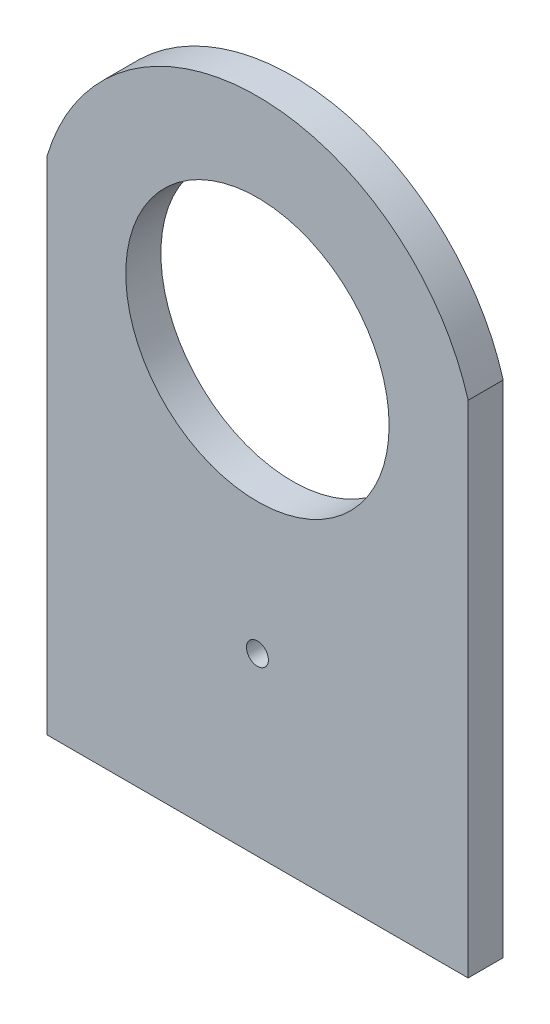
from build123d import *

# Parameters (mm, degrees)
SKETCH_1_R          = 30
EXTRUDE_1_DEPTH     = 8
SKETCH_2_R          = 2.5
CUT_EXTRUDE_1_DEPTH = 50
SKETCH_3_R          = 2.5
CUT_EXTRUDE_2_DEPTH = 20


with BuildPart() as part:
    # 草图1 → 凸台-拉伸1 (new body)
    with BuildSketch(Plane.XY):
        with BuildLine():
            Line((-48, 114), (-48, 0))
            Line((-48, 0), (48, 0))
            Line((48, 0), (48, 114))
            ThreePointArc((48, 114), (0, 150), (-48, 114))
        make_face()
        with Locations((0, 100)):
            Circle(SKETCH_1_R, mode=Mode.SUBTRACT)
    extrude(amount=EXTRUDE_1_DEPTH)

    # 草图2 → 切除-拉伸1 (cut)
    with BuildSketch(Plane.XZ):
        with Locations(Location((35, 4, 0), (0, 0, 270))):
            Circle(SKETCH_2_R)
        with Locations(Location((-35, 4, 0), (0, 0, 270))):
            Circle(SKETCH_2_R)
    extrude(amount=-CUT_EXTRUDE_1_DEPTH, mode=Mode.SUBTRACT)

    # 草图3 → 切除-拉伸2 (cut)
    with BuildSketch(Plane.XY.offset(8)):
        with Locations((0, 40)):
            Circle(SKETCH_3_R)
    extrude(amount=-CUT_EXTRUDE_2_DEPTH, mode=Mode.SUBTRACT)


solid = part.part
